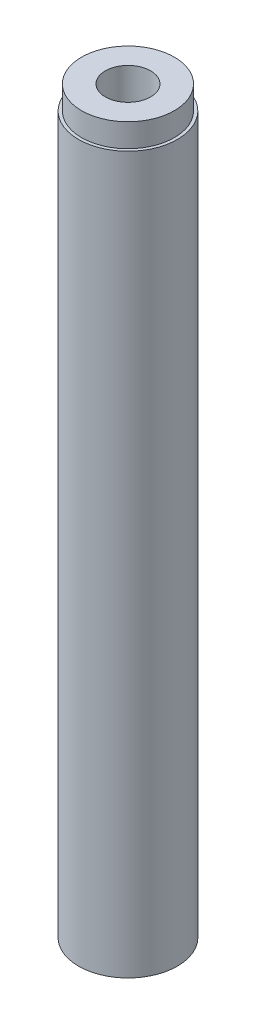
from build123d import *

# Parameters (mm, degrees)
SKETCH1_R           = 6.55
SKETCH1_R_2         = 3
BOSS_EXTRUDE1_DEPTH = 98
CUT_EXTRUDE1_START  = -3.1
SKETCH2_R           = 6.55
SKETCH2_R_2         = 6.15
CUT_EXTRUDE1_DEPTH  = 3.1


with BuildPart() as part:
    # Sketch1 → Boss-Extrude1 (new body)
    with BuildSketch(Plane(origin=(0, 0, 0), x_dir=(1, 0, 0), z_dir=(0, 1, 0))):
        with Locations(Location((0, 0, 0), (0, 0, 270))):
            Circle(SKETCH1_R)
        with Locations(Location((0, 0, 0), (0, 0, 270))):
            Circle(SKETCH1_R_2, mode=Mode.SUBTRACT)
    extrude(amount=BOSS_EXTRUDE1_DEPTH)

    # Sketch2 → Cut-Extrude1 (cut)
    with BuildSketch(Plane(origin=(0, 98, 0), x_dir=(1, 0, 0), z_dir=(0, 1, 0)).offset(CUT_EXTRUDE1_START)):
        with Locations(Location((0, 0, 0), (0, 0, 270))):
            Circle(SKETCH2_R)
        with Locations(Location((0, 0, 0), (0, 0, 270))):
            Circle(SKETCH2_R_2, mode=Mode.SUBTRACT)
    extrude(amount=CUT_EXTRUDE1_DEPTH, mode=Mode.SUBTRACT)


solid = part.part
